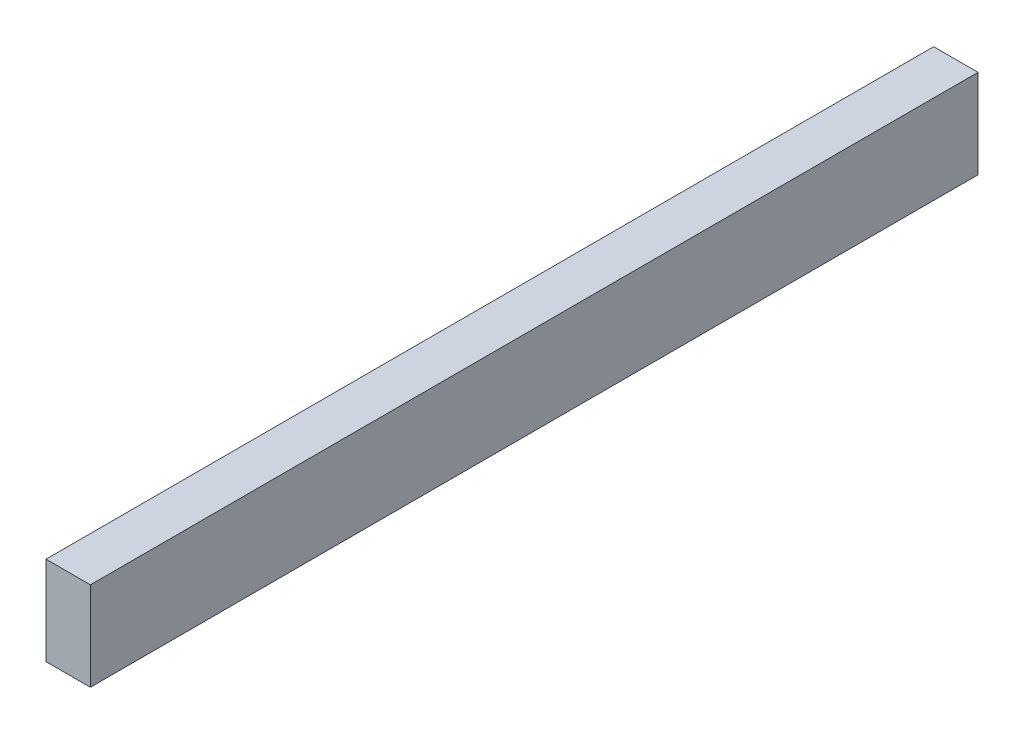
from build123d import *

# Parameters (mm, degrees)
SKIZZE1_W                       = 1.5
SKIZZE1_H                       = 3
AUFSATZ_LINEAR_AUSTRAGEN1_DEPTH = 30


with BuildPart() as part:
    # Skizze1 → Aufsatz-Linear austragen1 (new body)
    with BuildSketch(Plane.XY):
        with Locations((-1.223851351, -0.9975)):
            Rectangle(SKIZZE1_W, SKIZZE1_H)
    extrude(amount=AUFSATZ_LINEAR_AUSTRAGEN1_DEPTH)


solid = part.part
